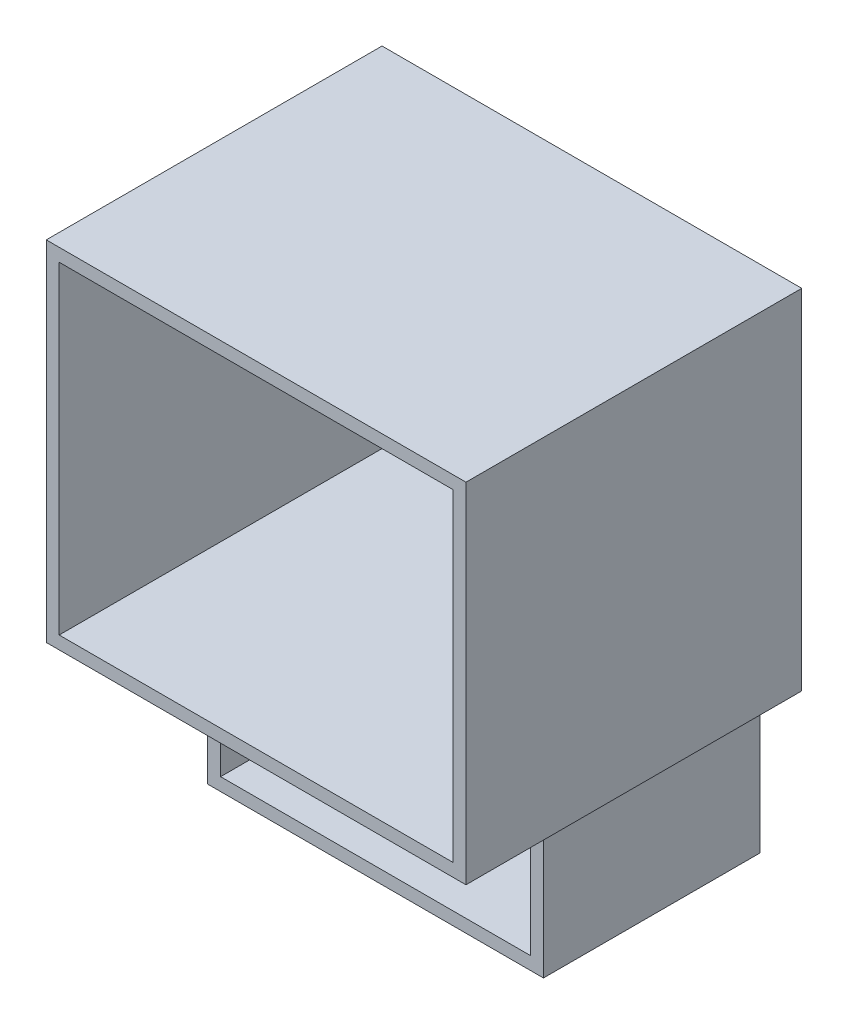
from build123d import *

# Parameters (mm, degrees)
SKETCH_1_W          = 65
SKETCH_1_H          = 54
SKETCH_1_R          = 1.5
EXTRUDE_1_DEPTH     = 2
SKETCH_2_W          = 65
SKETCH_2_H          = 54
SKETCH_2_W_2        = 61
SKETCH_2_H_2        = 50
EXTRUDE_2_DEPTH     = 50
SKETCH_6_W          = 52
SKETCH_6_H          = 25
SKETCH_6_R          = 1.8
EXTRUDE_3_DEPTH     = 3.5
EXTRUDE_4_DEPTH     = 30
SKETCH_8_R          = 3.1
CUT_EXTRUDE_1_DEPTH = 2.5


with BuildPart() as part:
    # 草图1 → 凸台-拉伸1 (new body)
    with BuildSketch(Plane.XY):
        Rectangle(SKETCH_1_W, SKETCH_1_H)
        with Locations((-26, 18.5)):
            Circle(SKETCH_1_R, mode=Mode.SUBTRACT)
        with Locations(Location((26, 18.5, 0), (0, 0, 180))):
            Circle(SKETCH_1_R, mode=Mode.SUBTRACT)
        with Locations(Location((-26, -18.5, 0), (0, 0, 180))):
            Circle(SKETCH_1_R, mode=Mode.SUBTRACT)
        with Locations((26, -18.5)):
            Circle(SKETCH_1_R, mode=Mode.SUBTRACT)
    extrude(amount=EXTRUDE_1_DEPTH)

    # 草图2 → 凸台-拉伸2 (add)
    with BuildSketch(Plane.XY.offset(2)):
        Rectangle(SKETCH_2_W, SKETCH_2_H)
        Rectangle(SKETCH_2_W_2, SKETCH_2_H_2, mode=Mode.SUBTRACT)
    extrude(amount=EXTRUDE_2_DEPTH)

    # 草图6 → 凸台-拉伸3 (add)
    with BuildSketch(Plane.XY):
        with Locations((0, -39.5)):
            Rectangle(SKETCH_6_W, SKETCH_6_H)
        with Locations((-18.8, -30)):
            Circle(SKETCH_6_R, mode=Mode.SUBTRACT)
        with Locations(Location((18.8, -30, 0), (0, 0, 180))):
            Circle(SKETCH_6_R, mode=Mode.SUBTRACT)
    extrude(amount=EXTRUDE_3_DEPTH)

    # 草图7 → 凸台-拉伸4 (add)
    with BuildSketch(Plane.XY.offset(3.5)):
        Polygon((-24, -27), (-26, -27), (-26, -52), (26, -52), (26, -27), (24, -27), (24, -50), (-24, -50), align=None)
    extrude(amount=EXTRUDE_4_DEPTH)

    # 草图8 → 切除-拉伸1 (cut)
    with BuildSketch(Plane(origin=(0, 0, 0), x_dir=(-1, 0, 0), z_dir=(0, 0, -1))):
        with Locations((-18.8, -30)):
            Circle(SKETCH_8_R)
        with Locations((18.8, -30)):
            Circle(SKETCH_8_R)
    extrude(amount=-CUT_EXTRUDE_1_DEPTH, mode=Mode.SUBTRACT)


solid = part.part
